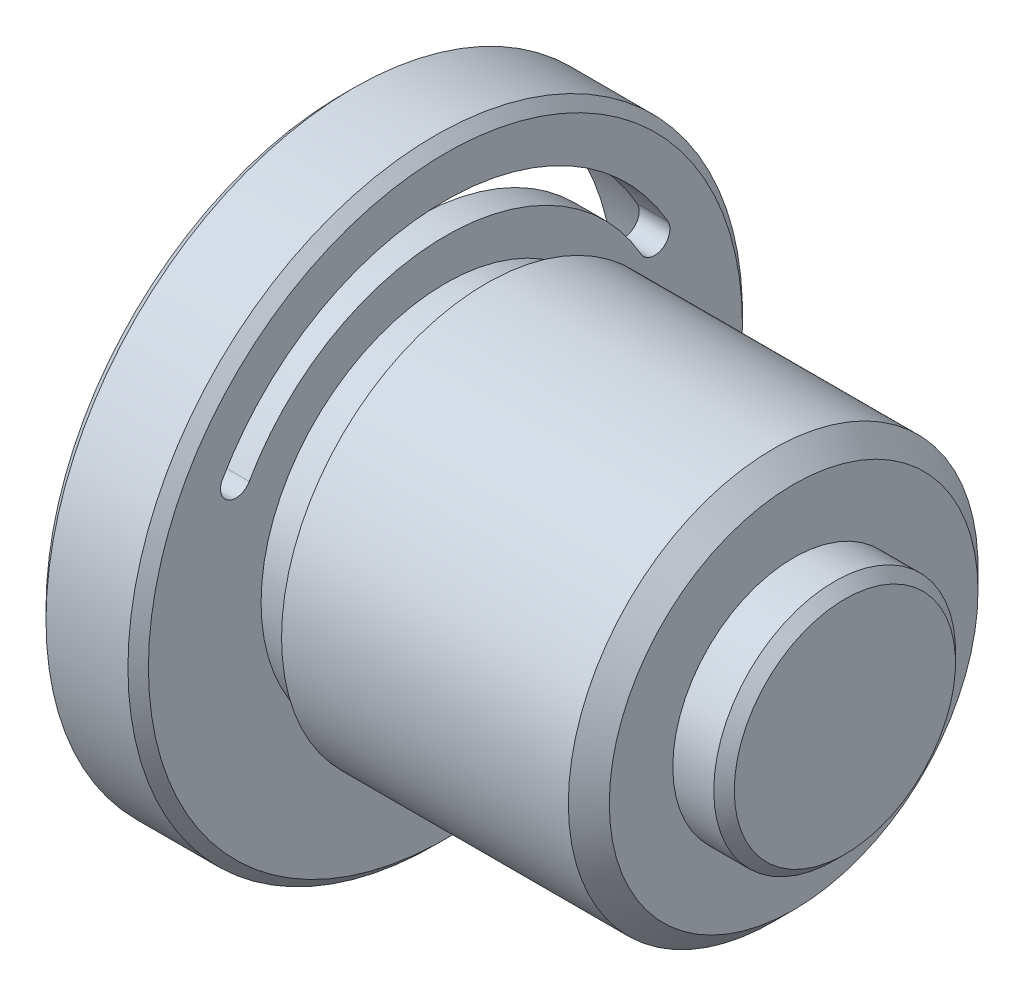
from build123d import *

# Parameters (mm, degrees)
CHAMFER1_SIZE  = 1
CHAMFER2_SIZE  = 0.5
EXTRUDE2_DEPTH = 10
CHAMFER3_SIZE  = 0.5
CHAMFER4_SIZE  = 0.2


with BuildPart() as part:
    # Sketch1 → Revolve1 (revolve)
    with BuildSketch(Plane.XY, mode=Mode.PRIVATE) as revolve1_sk:
        Polygon((0, 0), (0, 5.9), (-2.5, 5.9), (-2.5, 10), (-17.5, 10), (-17.5, 9), (-19.5, 9), (-19.5, 15), (-24.5, 15), (-24.5, 13), (-21, 13), (-21, 0), align=None)
    revolve(revolve1_sk.sketch.rotate(Axis((-24.5, 0, 0), (1, 0, 0)), 90), axis=Axis((-24.5, 0, 0), (1, 0, 0)))

    # Chamfer1
    chamfer1_edges = [part.edges().sort_by_distance(p)[0] for p in [
        (-2.5, 0, -10),
    ]]
    chamfer(chamfer1_edges, length=CHAMFER1_SIZE)

    # Chamfer2
    chamfer2_edges = [part.edges().sort_by_distance(p)[0] for p in [
        (0, 0, -5.9),
    ]]
    chamfer(chamfer2_edges, length=CHAMFER2_SIZE)

    # Sketch2 → Extrude2 (cut)
    with BuildSketch(Plane.ZY.offset(21)):
        with BuildLine():
            ThreePointArc((9.578114368, 5.40922593), (10.601186453, 5.129330555), (10.881081828, 6.152402641))
            ThreePointArc((10.881081828, 6.152402641), (0.026245134, 12.499972448), (-10.855150648, 6.198040369))
            ThreePointArc((-10.855150648, 6.198040369), (-10.859121552, 6.19108061), (-10.863087994, 6.184118308))
            ThreePointArc((-10.863087994, 6.184118308), (-10.579057999, 5.168029786), (-9.559993103, 5.441188461))
            ThreePointArc((-9.559993103, 5.441188461), (0.018371062, 10.999984659), (9.578114368, 5.40922593))
        make_face()
    extrude(amount=-EXTRUDE2_DEPTH, mode=Mode.SUBTRACT)

    # Chamfer3
    chamfer3_edges = [part.edges().sort_by_distance(p)[0] for p in [
        (-19.5, 0, -15),
        (-24.5, 0, -15),
    ]]
    chamfer(chamfer3_edges, length=CHAMFER3_SIZE)

    # Chamfer4
    chamfer4_edges = [part.edges().sort_by_distance(p)[0] for p in [
        (-24.5, 0, -13),
    ]]
    chamfer(chamfer4_edges, length=CHAMFER4_SIZE)


solid = part.part
